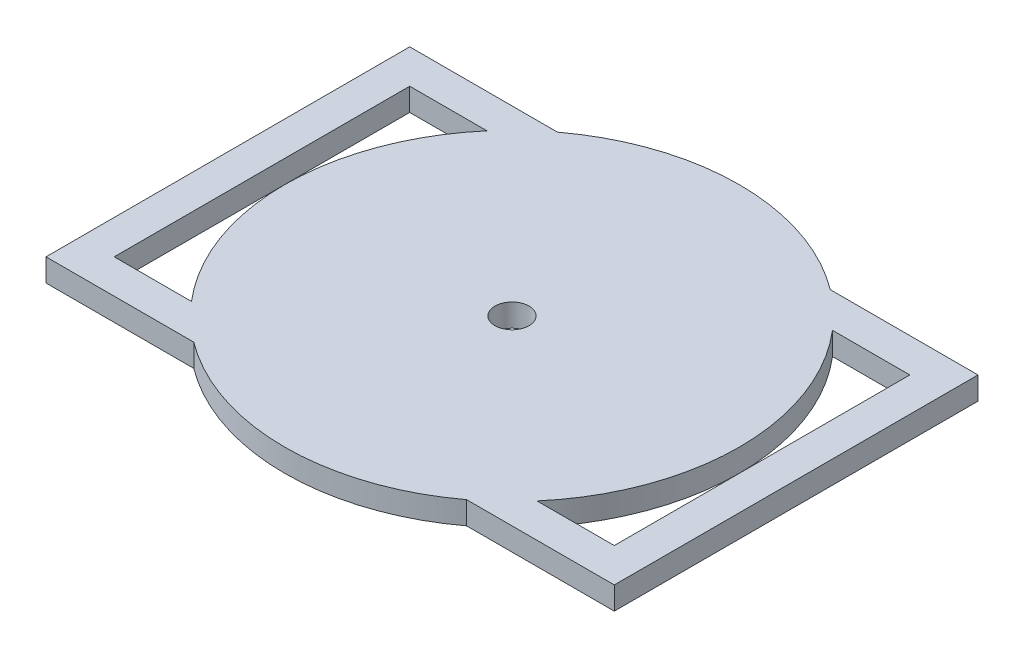
from build123d import *

# Parameters (mm, degrees)
SKETCH1_R           = 1.5
BOSS_EXTRUDE1_DEPTH = 2


with BuildPart() as part:
    # Sketch1 → Boss-Extrude1 (new body)
    with BuildSketch(Plane(origin=(0, 0, 0), x_dir=(1, 0, 0), z_dir=(0, 1, 0))):
        with BuildLine():
            Line((-25, -16), (-12, -16))
            ThreePointArc((-12, -16), (0, -20), (12, -16))
            Line((12, -16), (25, -16))
            Line((25, -16), (25, 16))
            Line((25, 16), (12, 16))
            ThreePointArc((12, 16), (0, 20), (-12, 16))
            Line((-12, 16), (-25, 16))
            Line((-25, 16), (-25, -16))
        make_face()
        with BuildLine():
            Line((-22, 13), (-15.198684154, 13))
            ThreePointArc((-15.198684154, 13), (-20, 0), (-15.198684154, -13))
            Line((-15.198684154, -13), (-22, -13))
            Line((-22, -13), (-22, 13))
        make_face(mode=Mode.SUBTRACT)
        with BuildLine():
            ThreePointArc((15.198684154, -13), (20, 0), (15.198684154, 13))
            Line((15.198684154, 13), (22, 13))
            Line((22, 13), (22, -13))
            Line((22, -13), (15.198684154, -13))
        make_face(mode=Mode.SUBTRACT)
        with Locations(Location((0, 0, 0), (0, 0, 270))):
            Circle(SKETCH1_R, mode=Mode.SUBTRACT)
    extrude(amount=BOSS_EXTRUDE1_DEPTH)


solid = part.part
